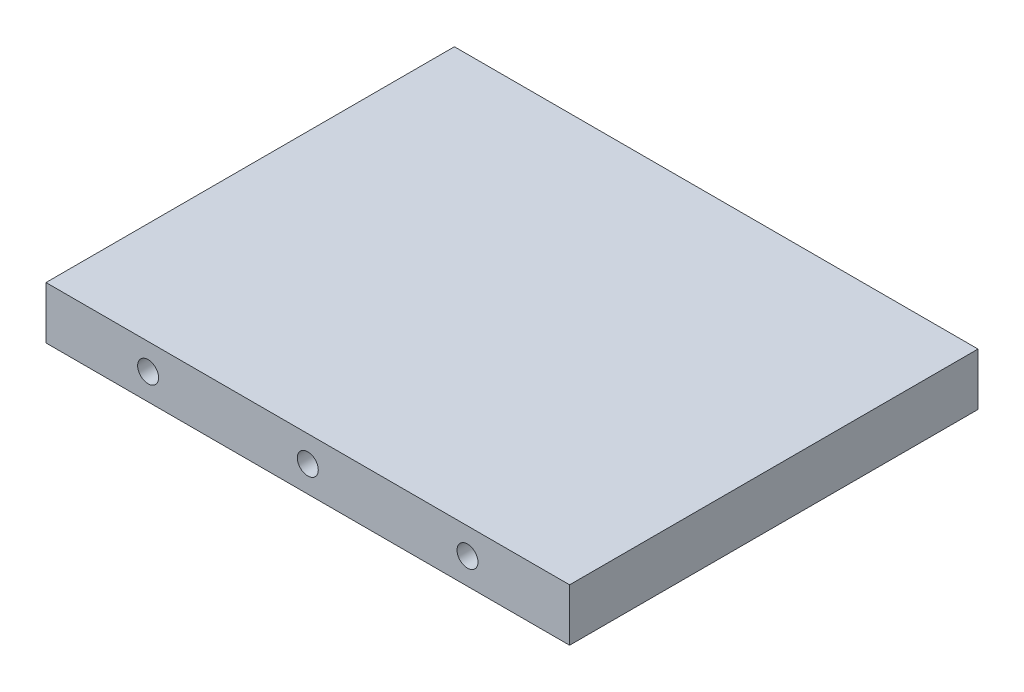
from build123d import *

# Parameters (mm, degrees)
SCHIZZO2_W                   = 100
SCHIZZO2_H                   = 10
ESTRUSIONE_ESTRUSIONE1_DEPTH = 78
SCHIZZO3_R                   = 2
TAGLIO_ESTRUSIONE1_DEPTH     = 15
TAGLIO_ESTRUSIONE2_START     = -15
SCHIZZO4_R                   = 2
TAGLIO_ESTRUSIONE2_DEPTH     = 15


with BuildPart() as part:
    # Schizzo2 → Estrusione-Estrusione1 (new body)
    with BuildSketch(Plane.XY):
        with Locations((50, 5)):
            Rectangle(SCHIZZO2_W, SCHIZZO2_H)
    extrude(amount=-ESTRUSIONE_ESTRUSIONE1_DEPTH)

    # Schizzo3 → Taglio-Estrusione1 (cut)
    with BuildSketch(Plane.XY):
        with Locations((19.5, 5)):
            Circle(SCHIZZO3_R)
        with Locations((50, 5)):
            Circle(SCHIZZO3_R)
        with Locations(Location((80.5, 5, 0), (0, 0, 180))):
            Circle(SCHIZZO3_R)
    extrude(amount=-TAGLIO_ESTRUSIONE1_DEPTH, mode=Mode.SUBTRACT)

    # Schizzo4 → Taglio-Estrusione2 (cut)
    with BuildSketch(Plane(origin=(0, 0, -78), x_dir=(-1, 0, 0), z_dir=(0, 0, -1)).offset(TAGLIO_ESTRUSIONE2_START)):
        with Locations((-80.5, 5)):
            Circle(SCHIZZO4_R)
        with Locations(Location((-50, 5, 0), (0, 0, 180))):
            Circle(SCHIZZO4_R)
        with Locations(Location((-19.5, 5, 0), (0, 0, 180))):
            Circle(SCHIZZO4_R)
    extrude(amount=TAGLIO_ESTRUSIONE2_DEPTH, mode=Mode.SUBTRACT)


solid = part.part
